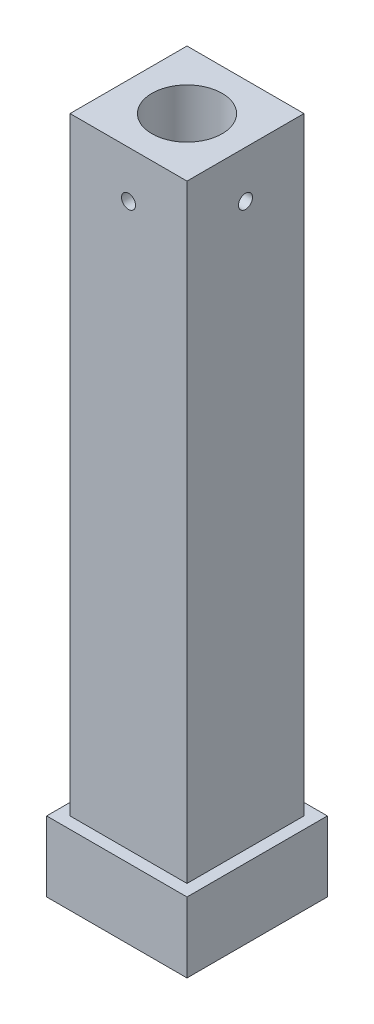
from build123d import *

# Parameters (mm, degrees)
SKETCH_1_W          = 5
SKETCH_1_H          = 5
EXTRUDE_1_DEPTH     = 29
SKETCH_1_5_W        = 6
SKETCH_1_5_H        = 6
EXTRUDE_2_DEPTH     = 3
SKETCH_1_3_R        = 1.5
CUT_EXTRUDE_1_DEPTH = 30.30870178
CUT_EXTRUDE_2_DEPTH = 2
SKETCH_3_R          = 0.3
CUT_EXTRUDE_3_DEPTH = 30.669007398
SKETCH_4_R          = 0.3
CUT_EXTRUDE_4_DEPTH = 30.669007496


with BuildPart() as part:
    # 草图1 → 凸台-拉伸1 (new body)
    with BuildSketch(Plane(origin=(0, 0, 0), x_dir=(1, 0, 0), z_dir=(0, 1, 0))):
        Rectangle(SKETCH_1_W, SKETCH_1_H)
    extrude(amount=EXTRUDE_1_DEPTH)

    # 草图1<5> → 凸台-拉伸2 (add)
    with BuildSketch(Plane(origin=(0, 0, 0), x_dir=(1, 0, 0), z_dir=(0, 1, 0))):
        Rectangle(SKETCH_1_5_W, SKETCH_1_5_H)
    extrude(amount=EXTRUDE_2_DEPTH)

    # 草图1<3> → 切除-拉伸1 (cut, through all)
    with BuildSketch(Plane(origin=(0, 0, 0), x_dir=(1, 0, 0), z_dir=(0, 1, 0))):
        Circle(SKETCH_1_3_R)
    extrude(amount=CUT_EXTRUDE_1_DEPTH, mode=Mode.SUBTRACT)

    # 草图1<4> → 切除-拉伸2 (cut)
    with BuildSketch(Plane(origin=(0, 0, 0), x_dir=(1, 0, 0), z_dir=(0, 1, 0))):
        Polygon((2.886751346, 0), (1.443375673, 2.5), (-1.443375673, 2.5), (-2.886751346, 0), (-1.443375673, -2.5), (1.443375673, -2.5), align=None)
    extrude(amount=CUT_EXTRUDE_2_DEPTH, mode=Mode.SUBTRACT)

    # 草图3 → 切除-拉伸3 (cut, through all)
    with BuildSketch(Plane.XY.offset(2.5)):
        with Locations((0, 27)):
            Circle(SKETCH_3_R)
    extrude(amount=-CUT_EXTRUDE_3_DEPTH, mode=Mode.SUBTRACT)

    # 草图4 → 切除-拉伸4 (cut, through all)
    with BuildSketch(Plane.ZY.offset(2.5)):
        with Locations((0, 27)):
            Circle(SKETCH_4_R)
    extrude(amount=-CUT_EXTRUDE_4_DEPTH, mode=Mode.SUBTRACT)


solid = part.part
